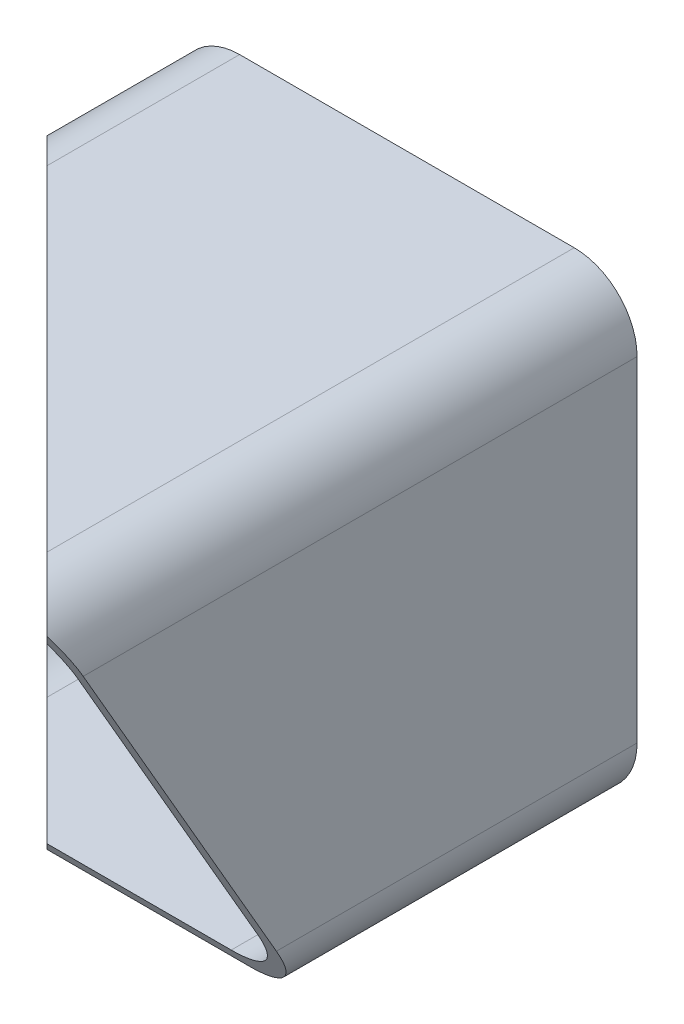
from build123d import *

# Parameters (mm, degrees)
SKETCH1_W           = 78
SKETCH1_H           = 78
SKETCH1_W_2         = 74
SKETCH1_H_2         = 74
BOSS_EXTRUDE1_DEPTH = 50
FILLET1_R           = 10.65
CUT_EXTRUDE1_DEPTH  = 101.523629063
CUT_EXTRUDE2_DEPTH  = 101.523629063


with BuildPart() as part:
    # Sketch1 → Boss-Extrude1 (new, symmetric)
    with BuildSketch(Plane.XY):
        Rectangle(SKETCH1_W, SKETCH1_H)
        Rectangle(SKETCH1_W_2, SKETCH1_H_2, mode=Mode.SUBTRACT)
    extrude(amount=BOSS_EXTRUDE1_DEPTH, both=True)

    # Fillet1
    fillet1_edges = [part.edges().sort_by_distance(p)[0] for p in [
        (37, -37, 0),
        (37, 37, 0),
        (-37, 37, 0),
        (-37, -37, 0),
        (39, -39, 0),
        (-39, -39, 0),
        (-39, 39, 0),
        (39, 39, 0),
    ]]
    fillet(fillet1_edges, radius=FILLET1_R)

    # Sketch2 → Cut-Extrude1 (cut, through all)
    with BuildSketch(Plane(origin=(39, 0, 0), x_dir=(0, 0, -1), z_dir=(1, 0, 0))):
        Polygon((-50, 39), (-50, -39), (-4.966679003, -39), align=None)
    extrude(amount=-CUT_EXTRUDE1_DEPTH, mode=Mode.SUBTRACT)

    # Sketch3 → Cut-Extrude2 (cut, through all)
    with BuildSketch(Plane(origin=(0, 39, 0), x_dir=(1, 0, 0), z_dir=(0, 1, 0))):
        Polygon((-39, -50), (39, -50), (-39, 28), align=None)
    extrude(amount=-CUT_EXTRUDE2_DEPTH, mode=Mode.SUBTRACT)


solid = part.part
